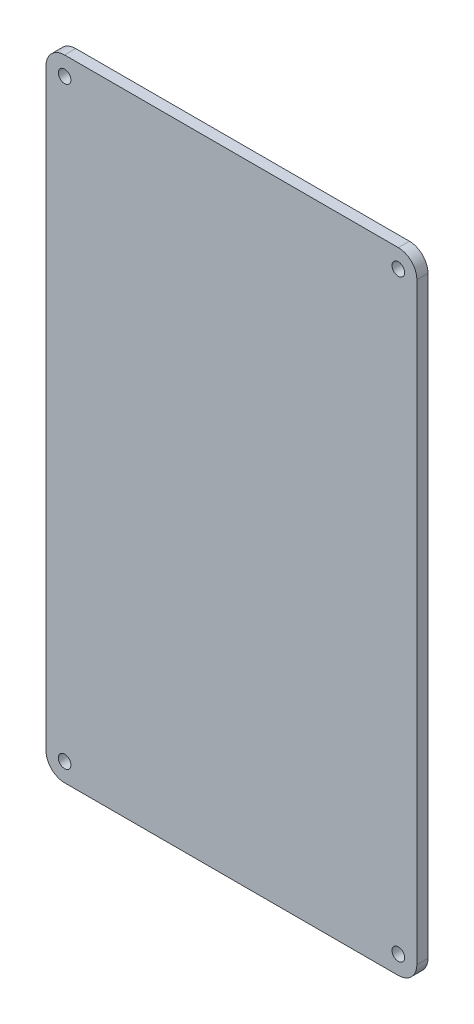
from build123d import *

# Parameters (mm, degrees)
SKETCH1_W                = 100
SKETCH1_H                = 170
BOSS_EXTRUDE1_DEPTH      = 3
M3_CLEARANCE_HOLE1_D     = 3.4
M3_CLEARANCE_HOLE1_DEPTH = 7.5
M3_CLEARANCE_HOLE1_TIP   = 1.021463052
FILLET1_R                = 5


with BuildPart() as part:
    # Sketch1 → Boss-Extrude1 (new body)
    with BuildSketch(Plane.XY):
        with Locations((50, 85)):
            Rectangle(SKETCH1_W, SKETCH1_H)
    extrude(amount=BOSS_EXTRUDE1_DEPTH)

    # M3 Clearance Hole1
    with Locations(Plane.XY.offset(3)):
        with Locations((5, 165), (95, 165), (95, 5), (5, 5)):
            Hole(M3_CLEARANCE_HOLE1_D / 2, depth=M3_CLEARANCE_HOLE1_DEPTH)
            with Locations((0, 0, -(M3_CLEARANCE_HOLE1_DEPTH + M3_CLEARANCE_HOLE1_TIP / 2))):  # 118° drill point
                Cone(0, M3_CLEARANCE_HOLE1_D / 2, M3_CLEARANCE_HOLE1_TIP, mode=Mode.SUBTRACT)

    # Fillet1
    fillet1_edges = [part.edges().sort_by_distance(p)[0] for p in [
        (0, 170, 1.5),
        (100, 170, 1.5),
        (100, 0, 1.5),
        (0, 0, 1.5),
    ]]
    fillet(fillet1_edges, radius=FILLET1_R)


solid = part.part
